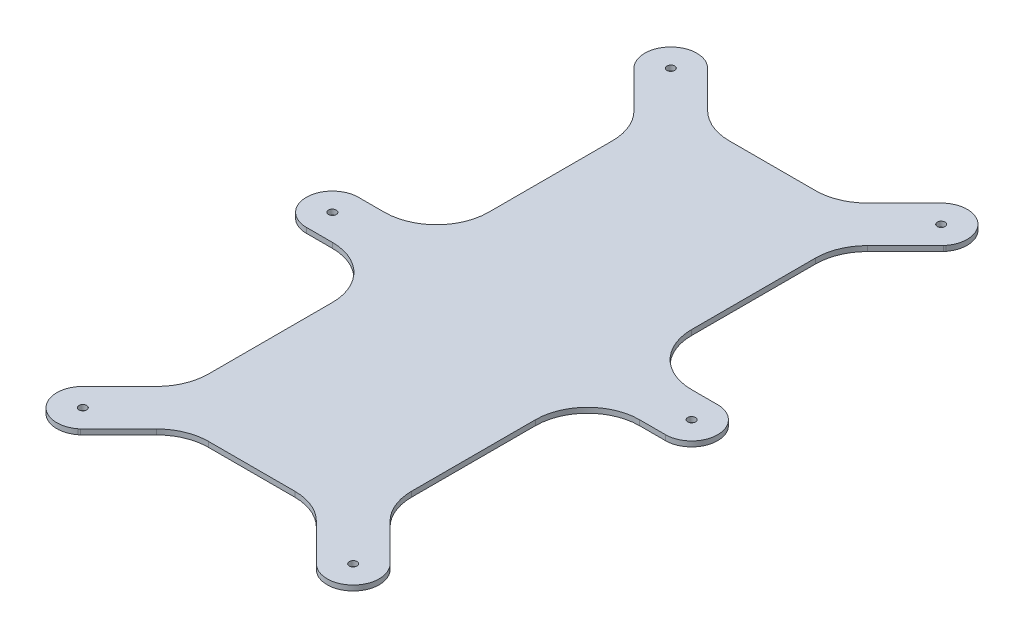
from build123d import *

# Parameters (mm, degrees)
EXTRUDE_1_DEPTH       = 2
CUT_EXTRUDE_1_DEPTH   = 147.138709345
MIRROR_2_COPY_1_DEPTH = 147.138709345
FILLET_1_R            = 20
SKETCH_4_R            = 1.5
CUT_EXTRUDE_2_DEPTH   = 147.138709345


with BuildPart() as part:
    # 草图2 → 凸台-拉伸1 (new body)
    with BuildSketch(Plane(origin=(0, 0, 0), x_dir=(1, 0, 0), z_dir=(0, 1, 0))):
        with BuildLine():
            Line((-69, -10), (-59, -10))
            ThreePointArc((-59, -10), (-44.857864376, -15.857864376), (-39, -30))
            Line((-39, -30), (-39, -73.141444367))
            ThreePointArc((-39, -73.141444367), (-40.081491111, -79.629126652), (-43.209002143, -85.415171865))
            Line((-43.209002143, -85.415171865), (-59.824431116, -106.792068439))
            ThreePointArc((-59.824431116, -106.792068439), (-59, -120), (-45.792068439, -120.824431116))
            Line((-45.792068439, -120.824431116), (-24.415171865, -104.209002143))
            ThreePointArc((-24.415171865, -104.209002143), (-18.629126652, -101.081491111), (-12.141444367, -100))
            Line((-12.141444367, -100), (12.141444367, -100))
            ThreePointArc((12.141444367, -100), (18.629126652, -101.081491111), (24.415171865, -104.209002143))
            Line((24.415171865, -104.209002143), (45.792068439, -120.824431116))
            ThreePointArc((45.792068439, -120.824431116), (59, -120), (59.824431116, -106.792068439))
            Line((59.824431116, -106.792068439), (43.209002143, -85.415171865))
            ThreePointArc((43.209002143, -85.415171865), (40.081491111, -79.629126652), (39, -73.141444367))
            Line((39, -73.141444367), (39, -30))
            ThreePointArc((39, -30), (44.857864376, -15.857864376), (59, -10))
            Line((59, -10), (69, -10))
            ThreePointArc((69, -10), (79, 0), (69, 10))
            Line((69, 10), (59, 10))
            ThreePointArc((59, 10), (44.857864376, 15.857864376), (39, 30))
            Line((39, 30), (39, 73.141444367))
            ThreePointArc((39, 73.141444367), (40.081491111, 79.629126652), (43.209002143, 85.415171865))
            Line((43.209002143, 85.415171865), (59.824431116, 106.792068439))
            ThreePointArc((59.824431116, 106.792068439), (59, 120), (45.792068439, 120.824431116))
            Line((45.792068439, 120.824431116), (24.415171865, 104.209002143))
            ThreePointArc((24.415171865, 104.209002143), (18.629126652, 101.081491111), (12.141444367, 100))
            Line((12.141444367, 100), (-12.141444367, 100))
            ThreePointArc((-12.141444367, 100), (-18.629126652, 101.081491111), (-24.415171865, 104.209002143))
            Line((-24.415171865, 104.209002143), (-45.792068439, 120.824431116))
            ThreePointArc((-45.792068439, 120.824431116), (-59, 120), (-59.824431116, 106.792068439))
            Line((-59.824431116, 106.792068439), (-43.209002143, 85.415171865))
            ThreePointArc((-43.209002143, 85.415171865), (-40.081491111, 79.629126652), (-39, 73.141444367))
            Line((-39, 73.141444367), (-39, 30))
            ThreePointArc((-39, 30), (-44.857864376, 15.857864376), (-59, 10))
            Line((-59, 10), (-69, 10))
            ThreePointArc((-69, 10), (-79, 0), (-69, -10))
        make_face()
    extrude(amount=EXTRUDE_1_DEPTH)

    # 草图3 → 切除-拉伸1 (cut, through all)
    with BuildSketch(Plane(origin=(0, 2, 0), x_dir=(1, 0, 0), z_dir=(0, 1, 0))):
        Polygon((24.857864376, 100), (12.141444367, 100), (45.299236161, 120.441371785), align=None)
        Polygon((39, 73.141444367), (59.441371785, 106.299236161), (39, 85.857864376), align=None)
    cut_extrude_1 = extrude(amount=-CUT_EXTRUDE_1_DEPTH, mode=Mode.SUBTRACT)

    # 镜向1: 切除-拉伸1 across plane
    add(cut_extrude_1.mirror(Plane.XY), mode=Mode.SUBTRACT)

    # 镜向2: 切除-拉伸1 across plane
    add(cut_extrude_1.mirror(Plane(origin=(0, 0, 0), x_dir=(0, 0, 1), z_dir=(1, 0, 0))), mode=Mode.SUBTRACT)

    # 镜向2 copy 1 sketch → 镜向2 copy 1 (cut, through all)
    with BuildSketch(Plane(origin=(0, 2, 0), x_dir=(-1, 0, 0), z_dir=(0, 1, 0))):
        Polygon((24.857864376, 100), (12.141444367, 100), (45.299236161, 120.441371785), align=None)
        Polygon((39, 73.141444367), (59.441371785, 106.299236161), (39, 85.857864376), align=None)
    extrude(amount=-MIRROR_2_COPY_1_DEPTH, mode=Mode.SUBTRACT)

    # 圆角1
    fillet_1_edges = [part.edges().sort_by_distance(p)[0] for p in [
        (39, 1, -85.857864376),
        (24.857864376, 1, -100),
        (39, 1, 85.857864376),
        (24.857864376, 1, 100),
        (-39, 1, -85.857864376),
        (-24.857864376, 1, -100),
        (-39, 1, 85.857864376),
        (-24.857864376, 1, 100),
    ]]
    fillet(fillet_1_edges, radius=FILLET_1_R)

    # 草图4 → 切除-拉伸2 (cut, through all)
    with BuildSketch(Plane(origin=(0, 2, 0), x_dir=(1, 0, 0), z_dir=(0, 1, 0))):
        with Locations(Location((69, 0, 0), (0, 0, 270))):
            Circle(SKETCH_4_R)
        with Locations(Location((51.928932188, 112.928932188, 0), (0, 0, 270))):
            Circle(SKETCH_4_R)
        with Locations(Location((51.928932188, -112.928932188, 0), (0, 0, 90))):
            Circle(SKETCH_4_R)
        with Locations(Location((-69, 0, 0), (0, 0, 90))):
            Circle(SKETCH_4_R)
        with Locations(Location((-51.928932188, 112.928932188, 0), (0, 0, 90))):
            Circle(SKETCH_4_R)
        with Locations(Location((-51.928932188, -112.928932188, 0), (0, 0, 270))):
            Circle(SKETCH_4_R)
    extrude(amount=-CUT_EXTRUDE_2_DEPTH, mode=Mode.SUBTRACT)


solid = part.part
